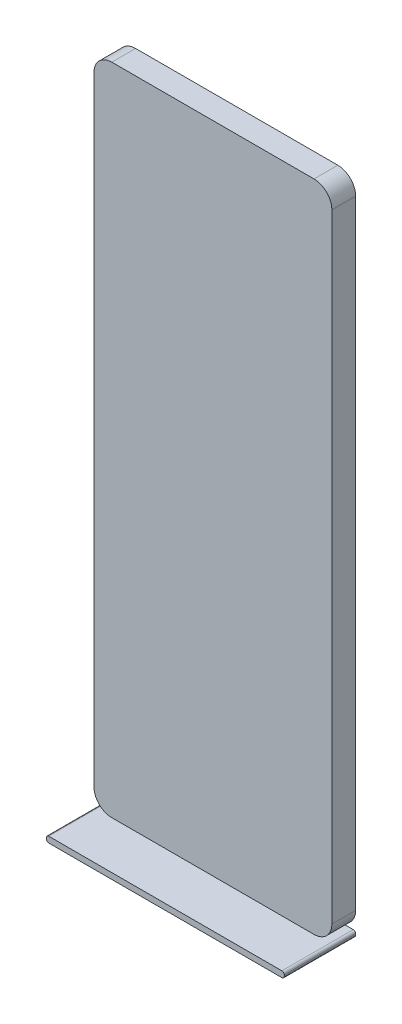
from build123d import *

# Parameters (mm, degrees)
EXTRUDE_233_DEPTH     = 4
CUT_EXTRUDE_382_DEPTH = 3
EXTRUDE_469_DEPTH     = 12


with BuildPart() as part:
    # 草图3 → Extrude 233 (new body)
    with BuildSketch(Plane.XY):
        with BuildLine():
            Line((-17, -55), (17, -55))
            ThreePointArc((17, -55), (19.121320344, -54.121320344), (20, -52))
            Line((20, -52), (20, 52))
            ThreePointArc((20, 52), (19.121320344, 54.121320344), (17, 55))
            Line((17, 55), (-17, 55))
            ThreePointArc((-17, 55), (-19.121320344, 54.121320344), (-20, 52))
            Line((-20, 52), (-20, -52))
            ThreePointArc((-20, -52), (-19.121320344, -54.121320344), (-17, -55))
        make_face()
    extrude(amount=EXTRUDE_233_DEPTH)

    # 草图4 → Cut-Extrude 382 (cut)
    with BuildSketch(Plane.XY):
        with BuildLine():
            Line((-16.75, -32.25), (-13.75, -32.25))
            ThreePointArc((-13.75, -32.25), (-12.335786438, -31.664213562), (-11.75, -30.25))
            Line((-11.75, -30.25), (-11.75, -24.25))
            ThreePointArc((-11.75, -24.25), (-12.335786438, -22.835786438), (-13.75, -22.25))
            Line((-13.75, -22.25), (-16.75, -22.25))
            ThreePointArc((-16.75, -22.25), (-18.164213562, -22.835786438), (-18.75, -24.25))
            Line((-18.75, -24.25), (-18.75, -30.25))
            ThreePointArc((-18.75, -30.25), (-18.164213562, -31.664213562), (-16.75, -32.25))
        make_face()
        with BuildLine():
            Line((-16.75, -1.75), (-13.75, -1.75))
            ThreePointArc((-13.75, -1.75), (-12.335786438, -1.164213562), (-11.75, 0.25))
            Line((-11.75, 0.25), (-11.75, 6.25))
            ThreePointArc((-11.75, 6.25), (-12.335786438, 7.664213562), (-13.75, 8.25))
            Line((-13.75, 8.25), (-16.75, 8.25))
            ThreePointArc((-16.75, 8.25), (-18.164213562, 7.664213562), (-18.75, 6.25))
            Line((-18.75, 6.25), (-18.75, 0.25))
            ThreePointArc((-18.75, 0.25), (-18.164213562, -1.164213562), (-16.75, -1.75))
        make_face()
        with BuildLine():
            Line((13.75, -32.25), (16.75, -32.25))
            ThreePointArc((16.75, -32.25), (18.164213562, -31.664213562), (18.75, -30.25))
            Line((18.75, -30.25), (18.75, -24.25))
            ThreePointArc((18.75, -24.25), (18.164213562, -22.835786438), (16.75, -22.25))
            Line((16.75, -22.25), (13.75, -22.25))
            ThreePointArc((13.75, -22.25), (12.335786438, -22.835786438), (11.75, -24.25))
            Line((11.75, -24.25), (11.75, -30.25))
            ThreePointArc((11.75, -30.25), (12.335786438, -31.664213562), (13.75, -32.25))
        make_face()
        with BuildLine():
            Line((13.75, -1.75), (16.75, -1.75))
            ThreePointArc((16.75, -1.75), (18.164213562, -1.164213562), (18.75, 0.25))
            Line((18.75, 0.25), (18.75, 6.25))
            ThreePointArc((18.75, 6.25), (18.164213562, 7.664213562), (16.75, 8.25))
            Line((16.75, 8.25), (13.75, 8.25))
            ThreePointArc((13.75, 8.25), (12.335786438, 7.664213562), (11.75, 6.25))
            Line((11.75, 6.25), (11.75, 0.25))
            ThreePointArc((11.75, 0.25), (12.335786438, -1.164213562), (13.75, -1.75))
        make_face()
    extrude(amount=CUT_EXTRUDE_382_DEPTH, mode=Mode.SUBTRACT)

    # 草图5 → Extrude 469 (add)
    with BuildSketch(Plane.XY):
        with BuildLine():
            Line((-19.6, -56), (19.6, -56))
            ThreePointArc((19.6, -56), (19.882842712, -55.882842712), (20, -55.6))
            Line((20, -55.6), (20, -55.4))
            ThreePointArc((20, -55.4), (19.882842712, -55.117157288), (19.6, -55))
            Line((19.6, -55), (-19.6, -55))
            ThreePointArc((-19.6, -55), (-19.882842712, -55.117157288), (-20, -55.4))
            Line((-20, -55.4), (-20, -55.6))
            ThreePointArc((-20, -55.6), (-19.882842712, -55.882842712), (-19.6, -56))
        make_face()
    extrude(amount=EXTRUDE_469_DEPTH)


solid = part.part
